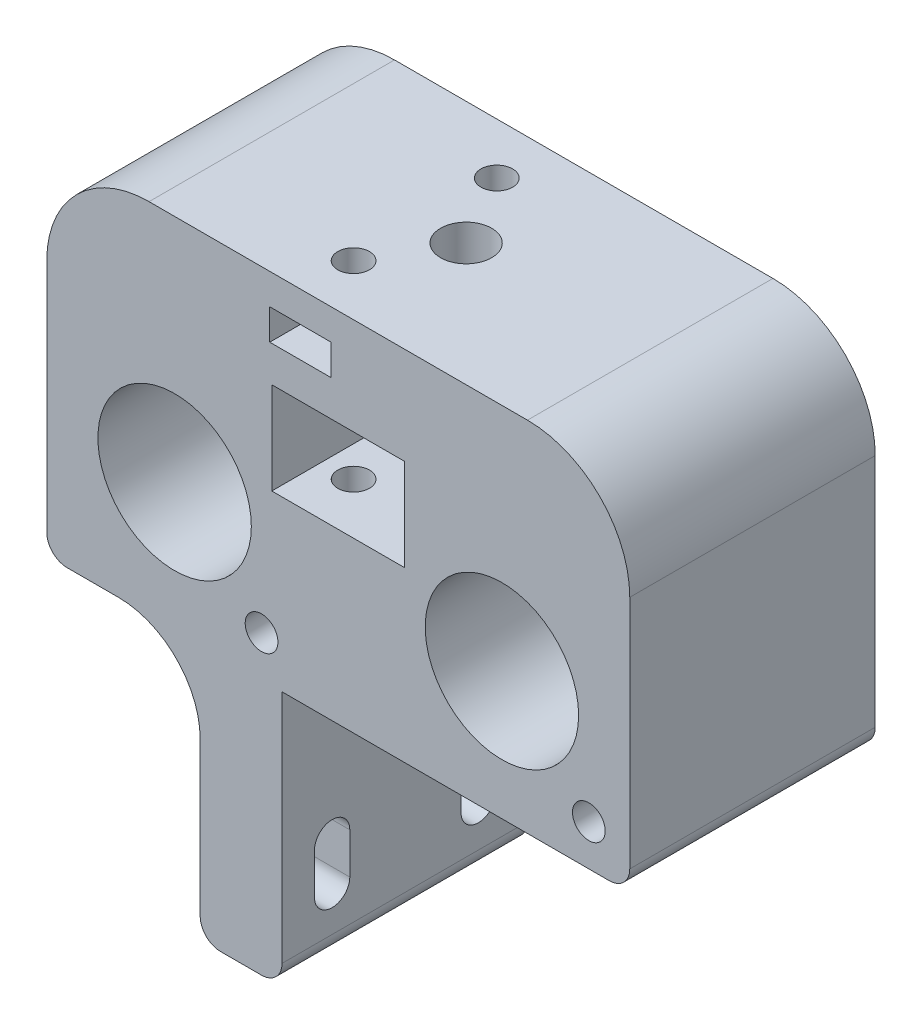
from build123d import *

# Parameters (mm, degrees)
SKETCH_1_W               = 57
SKETCH_1_H               = 24
EXTRUDE_1_DEPTH          = 25
SKETCH_2_R               = 7.5
CUT_EXTRUDE_1_DEPTH      = 48.647668573
SKETCH_3_W               = 8
SKETCH_3_H               = 24
EXTRUDE_2_DEPTH          = 25
CUT_EXTRUDE_2_DEPTH      = 51.361473246
CUT_EXTRUDE_2_DEPTH_BACK = 51.361473246
SKETCH_5_R               = 2.5
CUT_EXTRUDE_3_DEPTH      = 43.913614482
FILLET_1_R               = 8
SKETCH_6_W               = 57
SKETCH_6_H               = 24
SKETCH_6_R               = 2.5
EXTRUDE_3_DEPTH          = 10
CUT_EXTRUDE_4_DEPTH      = 54.575183811
SKETCH_8_R               = 1.55
CUT_EXTRUDE_5_DEPTH      = 70.401572806
SKETCH_9_W               = 6
SKETCH_9_H               = 3
CUT_EXTRUDE_6_DEPTH      = 8
SKETCH_10_W              = 6
SKETCH_10_H              = 3
CUT_EXTRUDE_7_DEPTH      = 8
SKETCH_11_R              = 1.6
CUT_EXTRUDE_8_DEPTH      = 54.575183811
FILLET_2_R               = 10
FILLET_3_R               = 2
FILLET_4_R               = 2


with BuildPart() as part:
    # 草图1 → 凸台-拉伸1 (new body)
    with BuildSketch(Plane(origin=(0, 0, 0), x_dir=(1, 0, 0), z_dir=(0, 1, 0))):
        with Locations((4.200157804, -0.135814249)):
            Rectangle(SKETCH_1_W, SKETCH_1_H)
    extrude(amount=EXTRUDE_1_DEPTH)

    # 草图2 → 切除-拉伸1 (cut, through all)
    with BuildSketch(Plane.XY.offset(12.135814249)):
        with Locations((-11.799842196, 12.5)):
            Circle(SKETCH_2_R)
        with Locations((20.200157804, 12.5)):
            Circle(SKETCH_2_R)
    extrude(amount=-CUT_EXTRUDE_1_DEPTH, mode=Mode.SUBTRACT)

    # 草图3 → 凸台-拉伸2 (add)
    with BuildSketch(Plane.XZ):
        with Locations((-5.299842196, 0.135814249)):
            Rectangle(SKETCH_3_W, SKETCH_3_H)
    extrude(amount=EXTRUDE_2_DEPTH)

    # 草图4 → 切除-拉伸2 (cut, two sides: drawn at the far end of the back side and taken through both)
    with BuildSketch(Plane.ZY.offset(9.299842196).offset(-CUT_EXTRUDE_2_DEPTH_BACK)):
        with BuildLine():
            Line((-8.758359631, -19), (-8.758359631, -15))
            ThreePointArc((-8.758359631, -15), (-7.064185751, -13.30582612), (-5.370011871, -15))
            Line((-5.370011871, -15), (-5.370011871, -19))
            ThreePointArc((-5.370011871, -19), (-7.064185751, -20.69417388), (-8.758359631, -19))
        make_face()
        with BuildLine():
            Line((5.509094538, -19), (5.509094538, -15))
            ThreePointArc((5.509094538, -15), (7.235814249, -13.273280289), (8.96253396, -15))
            Line((8.96253396, -15), (8.96253396, -19))
            ThreePointArc((8.96253396, -19), (7.235814249, -20.726719711), (5.509094538, -19))
        make_face()
    extrude(amount=CUT_EXTRUDE_2_DEPTH + CUT_EXTRUDE_2_DEPTH_BACK, mode=Mode.SUBTRACT)

    # 草图5 → 切除-拉伸3 (cut, through all)
    with BuildSketch(Plane.XZ):
        with Locations(Location((4.700157804, 0.135451208, 0), (0, 0, 270))):
            Circle(SKETCH_5_R)
    extrude(amount=-CUT_EXTRUDE_3_DEPTH, mode=Mode.SUBTRACT)

    # 圆角1
    fillet_1_edges = [part.edges().sort_by_distance(p)[0] for p in [
        (-9.299842196, 0, 0.135814249),
    ]]
    fillet(fillet_1_edges, radius=FILLET_1_R)

    # 草图6 → 凸台-拉伸3 (add)
    with BuildSketch(Plane(origin=(0, 25, 0), x_dir=(1, 0, 0), z_dir=(0, 1, 0))):
        with Locations((4.200157804, -0.135814249)):
            Rectangle(SKETCH_6_W, SKETCH_6_H)
        with Locations(Location((4.700157804, -0.135451208, 0), (0, 0, 90))):
            Circle(SKETCH_6_R, mode=Mode.SUBTRACT)
    extrude(amount=EXTRUDE_3_DEPTH)

    # 草图7 → 切除-拉伸4 (cut, through all)
    with BuildSketch(Plane.XY.offset(12.135814249)):
        Polygon((-2.299842196, 25.5), (2.700157804, 25.5), (5.700157804, 25.5), (10.700157804, 25.5), (10.700157804, 16.5), (5.700157804, 16.5), (2.700157804, 16.5), (-2.299842196, 16.5), align=None)
    extrude(amount=-CUT_EXTRUDE_4_DEPTH, mode=Mode.SUBTRACT)

    # 草图8 → 切除-拉伸5 (cut, through all)
    with BuildSketch(Plane(origin=(0, 35, 0), x_dir=(1, 0, 0), z_dir=(0, 1, 0))):
        with Locations(Location((0.700157804, -7.135814249, 0), (0, 0, 270))):
            Circle(SKETCH_8_R)
        with Locations(Location((0.700157804, 6.864185751, 0), (0, 0, 270))):
            Circle(SKETCH_8_R)
    extrude(amount=-CUT_EXTRUDE_5_DEPTH, mode=Mode.SUBTRACT)

    # 草图9 → 切除-拉伸6 (cut)
    with BuildSketch(Plane.XY.offset(12.135814249)):
        with Locations((0.500157804, 30.5)):
            Rectangle(SKETCH_9_W, SKETCH_9_H)
    extrude(amount=-CUT_EXTRUDE_6_DEPTH, mode=Mode.SUBTRACT)

    # 草图10 → 切除-拉伸7 (cut)
    with BuildSketch(Plane(origin=(0, 0, -11.864185751), x_dir=(-1, 0, 0), z_dir=(0, 0, -1))):
        with Locations((-0.500157804, 30.5)):
            Rectangle(SKETCH_10_W, SKETCH_10_H)
    extrude(amount=-CUT_EXTRUDE_7_DEPTH, mode=Mode.SUBTRACT)

    # 草图11 → 切除-拉伸8 (cut, through all)
    with BuildSketch(Plane(origin=(0, 0, -11.864185751), x_dir=(-1, 0, 0), z_dir=(0, 0, -1))):
        with Locations((-28.700157804, 4)):
            Circle(SKETCH_11_R)
        with Locations((3.299842196, 4)):
            Circle(SKETCH_11_R)
    extrude(amount=-CUT_EXTRUDE_8_DEPTH, mode=Mode.SUBTRACT)

    # 圆角2
    fillet_2_edges = [part.edges().sort_by_distance(p)[0] for p in [
        (-24.299842196, 35, 0.135814249),
        (32.700157804, 35, 0.135814249),
    ]]
    fillet(fillet_2_edges, radius=FILLET_2_R)

    # 圆角3
    fillet_3_edges = [part.edges().sort_by_distance(p)[0] for p in [
        (32.700157804, 0, 0.135814249),
        (-24.299842196, 0, 0.135814249),
    ]]
    fillet(fillet_3_edges, radius=FILLET_3_R)

    # 圆角4
    fillet_4_edges = [part.edges().sort_by_distance(p)[0] for p in [
        (-9.299842196, -25, 0.135814249),
        (-1.299842196, -25, 0.135814249),
    ]]
    fillet(fillet_4_edges, radius=FILLET_4_R)


solid = part.part
